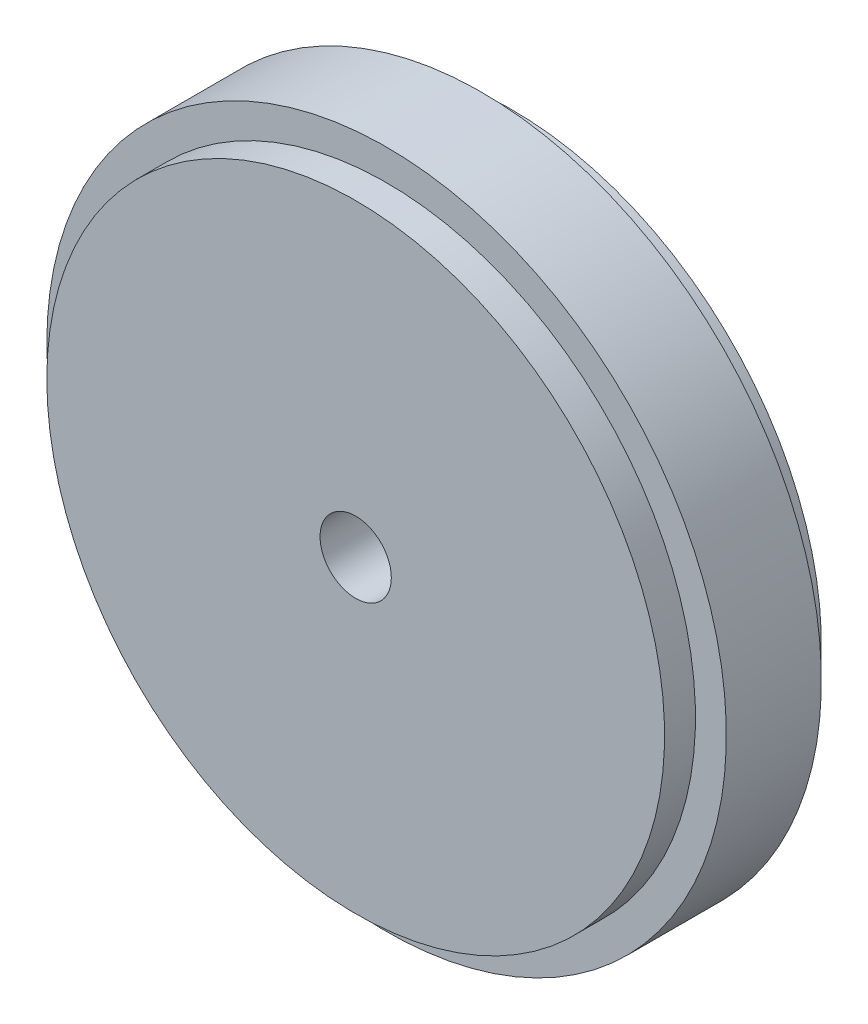
from build123d import *

# Parameters (mm, degrees)
SKETCH3_R          = 1.5
CUT_EXTRUDE1_DEPTH = 22.975895886


with BuildPart() as part:
    # Sketch1 → Revolve1 (revolve)
    with BuildSketch(Plane(origin=(0, 0, 0), x_dir=(0, 0, -1), z_dir=(1, 0, 0)), mode=Mode.PRIVATE) as revolve1_sk:
        Polygon((6.6, 13), (5.3, 13), (5.3, 14.3), (1.3, 14.3), (1.3, 13), (0, 13), (0, 0), (8.6, 0), (8.6, 3.5), (6.6, 3.5), align=None)
    revolve(revolve1_sk.sketch.rotate(Axis((0, 0, -12.817719844), (0, 0, 1)), 90), axis=Axis((0, 0, -12.817719844), (0, 0, 1)))

    # Sketch3 → Cut-Extrude1 (cut, through all)
    with BuildSketch(Plane.XY):
        Circle(SKETCH3_R)
    extrude(amount=-CUT_EXTRUDE1_DEPTH, mode=Mode.SUBTRACT)


solid = part.part
